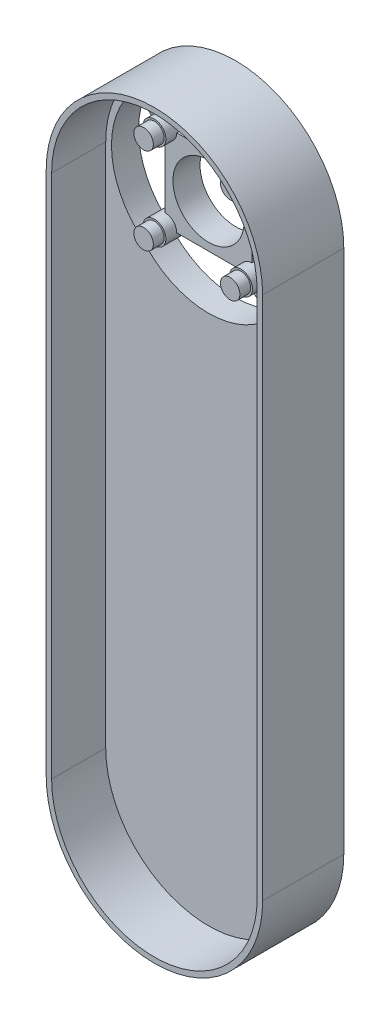
from build123d import *
from build123d.topology import SkipClean

# Parameters (mm, degrees)
SKETCH2_R           = 6.575
BOSS_EXTRUDE1_DEPTH = 5
SKETCH4_R           = 2.125
BOSS_EXTRUDE3_DEPTH = 2
SKETCH5_R           = 1.8
BOSS_EXTRUDE4_DEPTH = 2
BOSS_EXTRUDE5_DEPTH = 10
CUT_EXTRUDE1_START  = -10
CUT_EXTRUDE1_DEPTH  = 10
CUT_EXTRUDE2_DEPTH  = 10


with BuildPart() as part:
    # Sketch2 → Boss-Extrude1 (new body)
    with BuildSketch(Plane.XY):
        with BuildLine():
            Line((-20, 0), (-20, -97))
            ThreePointArc((-20, -97), (0, -117), (20, -97))
            Line((20, -97), (20, 0))
            ThreePointArc((20, 0), (0, 20), (-20, 0))
        make_face()
        Circle(SKETCH2_R, mode=Mode.SUBTRACT)
    extrude(amount=BOSS_EXTRUDE1_DEPTH)

    # Sketch4 → Boss-Extrude3 (add)
    with BuildSketch(Plane.XY.offset(5)):
        with Locations((-8, 8)):
            Circle(SKETCH4_R)
        with Locations((8, 8)):
            Circle(SKETCH4_R)
        with Locations((8, -8)):
            Circle(SKETCH4_R)
        with Locations((-8, -8)):
            Circle(SKETCH4_R)
    extrude(amount=BOSS_EXTRUDE3_DEPTH)

    # Sketch5 → Boss-Extrude4 (add)
    with BuildSketch(Plane.XY.offset(7)):
        with Locations((-8, 8)):
            Circle(SKETCH5_R)
        with Locations((8, 8)):
            Circle(SKETCH5_R)
        with Locations((8, -8)):
            Circle(SKETCH5_R)
        with Locations((-8, -8)):
            Circle(SKETCH5_R)
    extrude(amount=BOSS_EXTRUDE4_DEPTH)

    # Sketch6 → Boss-Extrude5 (add)
    with BuildSketch(Plane.XY.offset(5)):
        with BuildLine():
            Line((20, -97), (20, 0))
            ThreePointArc((20, 0), (0, 20), (-20, 0))
            Line((-20, 0), (-20, -97))
            ThreePointArc((-20, -97), (0, -117), (20, -97))
        make_face()
        with BuildLine():
            Line((-19, 0), (-19, -97))
            ThreePointArc((-19, -97), (0, -116), (19, -97))
            Line((19, -97), (19, 0))
            ThreePointArc((19, 0), (0, 19), (-19, 0))
        make_face(mode=Mode.SUBTRACT)
    extrude(amount=BOSS_EXTRUDE5_DEPTH)

    # Sketch7 → Cut-Extrude1 (cut)
    with BuildSketch(Plane.XY.offset(5).offset(CUT_EXTRUDE1_START)):
        with BuildLine():
            Line((-10.125, 8), (-10.125, -8))
            ThreePointArc((-10.125, -8), (-9.50260191, -6.49739809), (-8, -5.875))
            Line((-8, -5.875), (-8, 5.875))
            ThreePointArc((-8, 5.875), (-9.50260191, 6.49739809), (-10.125, 8))
        make_face()
        with BuildLine():
            Line((-8, -10.125), (8, -10.125))
            ThreePointArc((8, -10.125), (6.49739809, -9.50260191), (5.875, -8))
            Line((5.875, -8), (-5.875, -8))
            ThreePointArc((-5.875, -8), (-6.49739809, -9.50260191), (-8, -10.125))
        make_face()
        with BuildLine():
            Line((10.125, -8), (10.125, 8))
            ThreePointArc((10.125, 8), (9.50260191, 6.49739809), (8, 5.875))
            Line((8, 5.875), (8, -5.875))
            ThreePointArc((8, -5.875), (9.50260191, -6.49739809), (10.125, -8))
        make_face()
        with BuildLine():
            Line((8, 10.125), (-8, 10.125))
            ThreePointArc((-8, 10.125), (-6.49739809, 9.50260191), (-5.875, 8))
            Line((-5.875, 8), (5.875, 8))
            ThreePointArc((5.875, 8), (6.49739809, 9.50260191), (8, 10.125))
        make_face()
    extrude(amount=CUT_EXTRUDE1_DEPTH, mode=Mode.SUBTRACT)

    # Sketch10 → Cut-Extrude2 (cut)
    with SkipClean():  # the faces are left unmerged after this step: merging them gives an invalid solid
        with BuildSketch(Plane(origin=(0, 0, 0), x_dir=(-1, 0, 0), z_dir=(0, 0, -1))):
            with BuildLine():
                Line((-8, 10.125), (-11.181980515, 13.306980515))
                ThreePointArc((-11.181980515, 13.306980515), (0, 17.938708499), (11.181980515, 13.306980515))
                Line((11.181980515, 13.306980515), (8, 10.125))
                Line((8, 10.125), (-8, 10.125))
            make_face()
            with BuildLine():
                Line((-10.125, 8), (-13.306980515, 11.181980515))
                ThreePointArc((-13.306980515, 11.181980515), (-17.938708499, 0), (-13.306980515, -11.181980515))
                Line((-13.306980515, -11.181980515), (-10.125, -8))
                Line((-10.125, -8), (-10.125, 8))
            make_face()
            with BuildLine():
                Line((10.125, 8), (13.306980515, 11.181980515))
                ThreePointArc((13.306980515, 11.181980515), (17.938708499, 0), (13.306980515, -11.181980515))
                Line((13.306980515, -11.181980515), (10.125, -8))
                Line((10.125, -8), (10.125, 8))
            make_face()
            with BuildLine():
                Line((8, -10.125), (11.181980515, -13.306980515))
                ThreePointArc((11.181980515, -13.306980515), (0, -17.938708499), (-11.181980515, -13.306980515))
                Line((-11.181980515, -13.306980515), (-8, -10.125))
                Line((-8, -10.125), (8, -10.125))
            make_face()
        extrude(amount=-CUT_EXTRUDE2_DEPTH, mode=Mode.SUBTRACT)


solid = part.part
